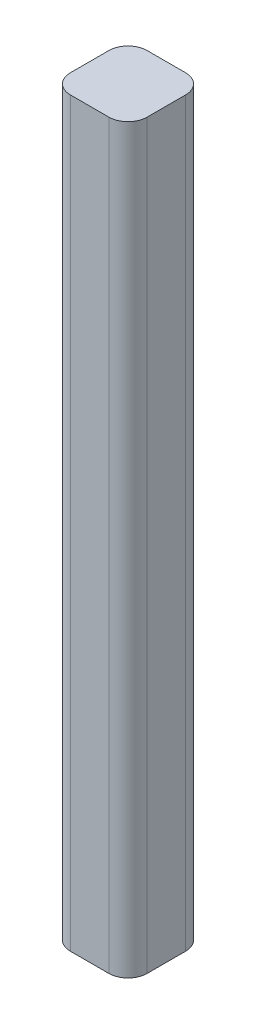
from build123d import *

# Parameters (mm, degrees)
RESSALTO_EXTRUS_O1_DEPTH = 77.25


with BuildPart() as part:
    # Esboço1 → Ressalto-extrusão1 (new body)
    with BuildSketch(Plane(origin=(0, 0, 0), x_dir=(1, 0, 0), z_dir=(0, 1, 0))):
        with BuildLine():
            Line((-2, -4), (2, -4))
            ThreePointArc((2, -4), (3.414213562, -3.414213562), (4, -2))
            Line((4, -2), (4, 2))
            ThreePointArc((4, 2), (3.414213562, 3.414213562), (2, 4))
            Line((2, 4), (-2, 4))
            ThreePointArc((-2, 4), (-3.414213562, 3.414213562), (-4, 2))
            Line((-4, 2), (-4, -2))
            ThreePointArc((-4, -2), (-3.414213562, -3.414213562), (-2, -4))
        make_face()
    extrude(amount=RESSALTO_EXTRUS_O1_DEPTH)


solid = part.part
